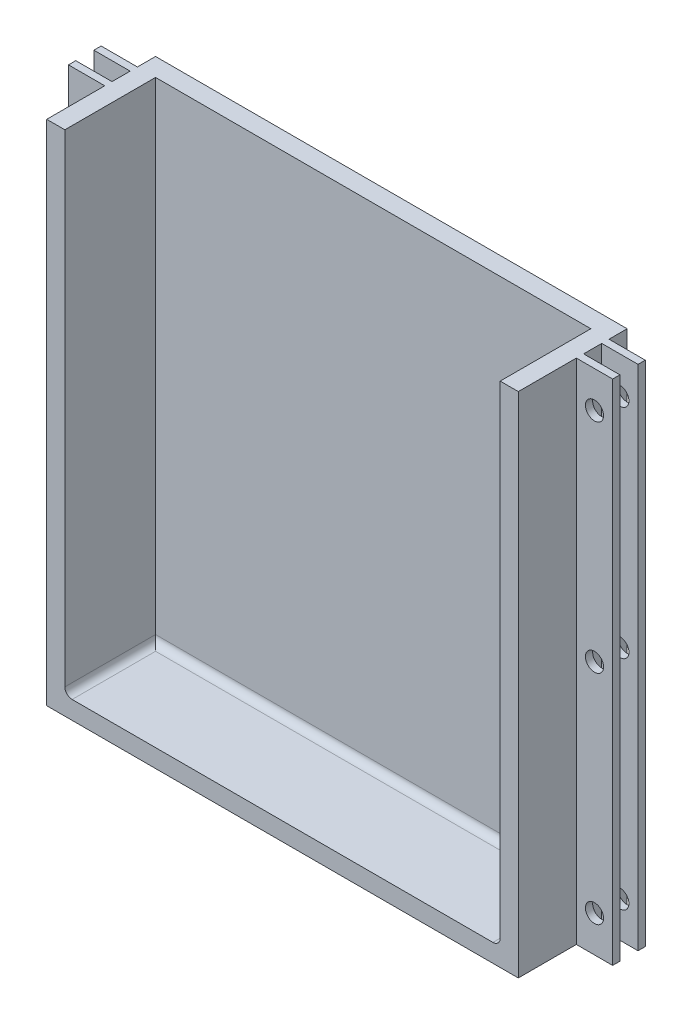
from build123d import *

# Parameters (mm, degrees)
BOSS_EXTRUDE1_DEPTH = 177.8
SKETCH2_W           = 12.7
SKETCH2_H           = 2.54
BOSS_EXTRUDE2_DEPTH = 177.8
SKETCH3_R           = 3.175
CUT_EXTRUDE1_DEPTH  = 203.727168628
SKETCH4_W           = 31.75
SKETCH4_H           = 6.35
BOSS_EXTRUDE3_DEPTH = 152.4
FILLET1_R           = 2.54


with BuildPart() as part:
    # Sketch1 → Boss-Extrude1 (new body)
    with BuildSketch(Plane(origin=(0, 0, 0), x_dir=(1, 0, 0), z_dir=(0, 1, 0))):
        Polygon((76.2, 0), (82.55, 0), (82.55, 38.1), (-82.55, 38.1), (-82.55, 0), (-76.2, 0), (-76.2, 31.75), (76.2, 31.75), align=None)
    extrude(amount=BOSS_EXTRUDE1_DEPTH)

    # Sketch2 → Boss-Extrude2 (add)
    with BuildSketch(Plane(origin=(0, 177.8, 0), x_dir=(1, 0, 0), z_dir=(0, 1, 0))):
        with Locations((88.9, 30.48)):
            Rectangle(SKETCH2_W, SKETCH2_H)
        with Locations((88.9, 21.59)):
            Rectangle(SKETCH2_W, SKETCH2_H)
        with Locations((-88.9, 21.59)):
            Rectangle(SKETCH2_W, SKETCH2_H)
        with Locations((-88.9, 30.48)):
            Rectangle(SKETCH2_W, SKETCH2_H)
    extrude(amount=-BOSS_EXTRUDE2_DEPTH)

    # Sketch3 → Cut-Extrude1 (cut, through all)
    with BuildSketch(Plane.XY.offset(-20.32)):
        with Locations((88.9, 12.7)):
            Circle(SKETCH3_R)
        with Locations((88.9, 88.9)):
            Circle(SKETCH3_R)
        with Locations((88.9, 165.1)):
            Circle(SKETCH3_R)
        with Locations((-88.9, 12.7)):
            Circle(SKETCH3_R)
        with Locations((-88.9, 165.1)):
            Circle(SKETCH3_R)
        with Locations((-88.9, 88.9)):
            Circle(SKETCH3_R)
    extrude(amount=-CUT_EXTRUDE1_DEPTH, mode=Mode.SUBTRACT)

    # Sketch4 → Boss-Extrude3 (add)
    with BuildSketch(Plane(origin=(-76.2, 0, 0), x_dir=(0, 0, -1), z_dir=(1, 0, 0))):
        with Locations((15.875, 3.175)):
            Rectangle(SKETCH4_W, SKETCH4_H)
    extrude(amount=BOSS_EXTRUDE3_DEPTH)

    # Fillet1
    fillet1_edges = [part.edges().sort_by_distance(p)[0] for p in [
        (76.2, 6.35, -15.875),
        (0, 6.35, -31.75),
        (-76.2, 6.35, -15.875),
    ]]
    fillet(fillet1_edges, radius=FILLET1_R)


solid = part.part
